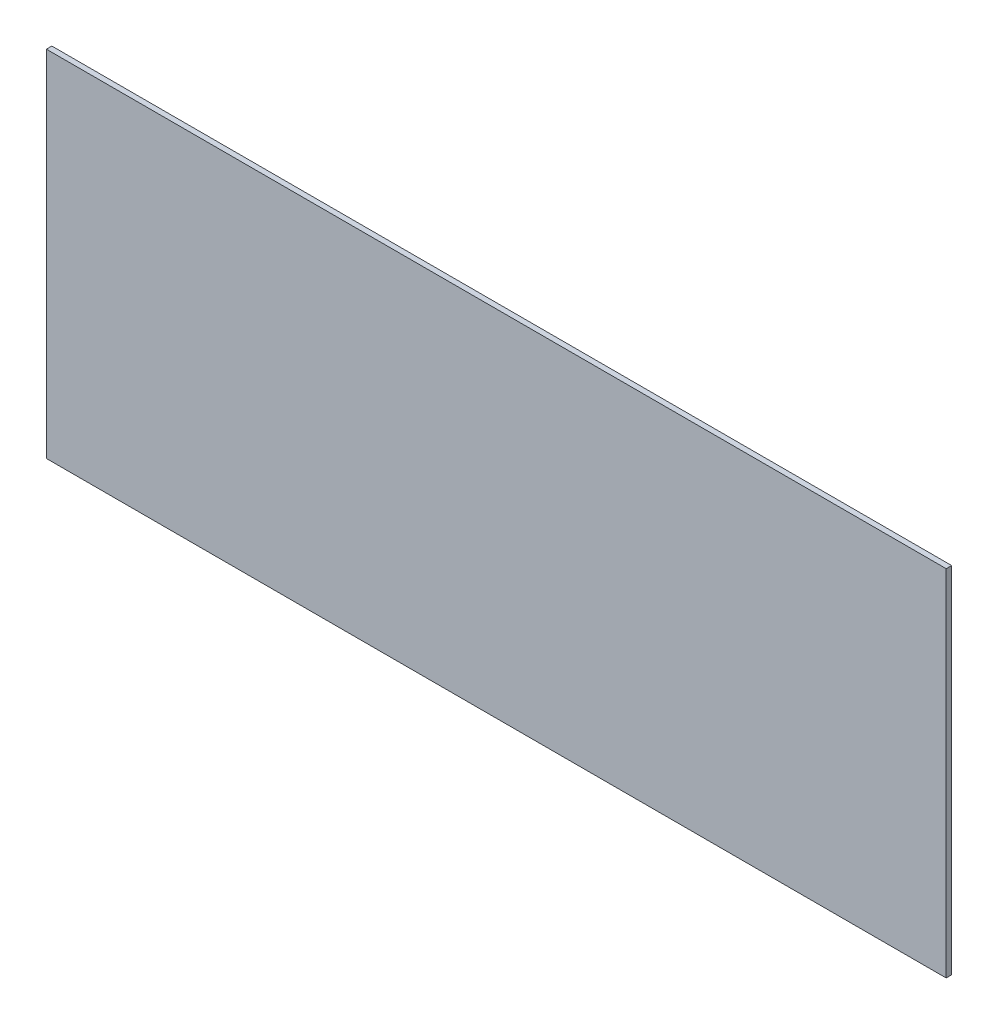
from build123d import *

# Parameters (mm, degrees)
SKETCH2_W           = 165
SKETCH2_H           = 65
BOSS_EXTRUDE1_DEPTH = 1


with BuildPart() as part:
    # Sketch2 → Boss-Extrude1 (new body)
    with BuildSketch(Plane.XY):
        Rectangle(SKETCH2_W, SKETCH2_H)
    extrude(amount=BOSS_EXTRUDE1_DEPTH)


solid = part.part
